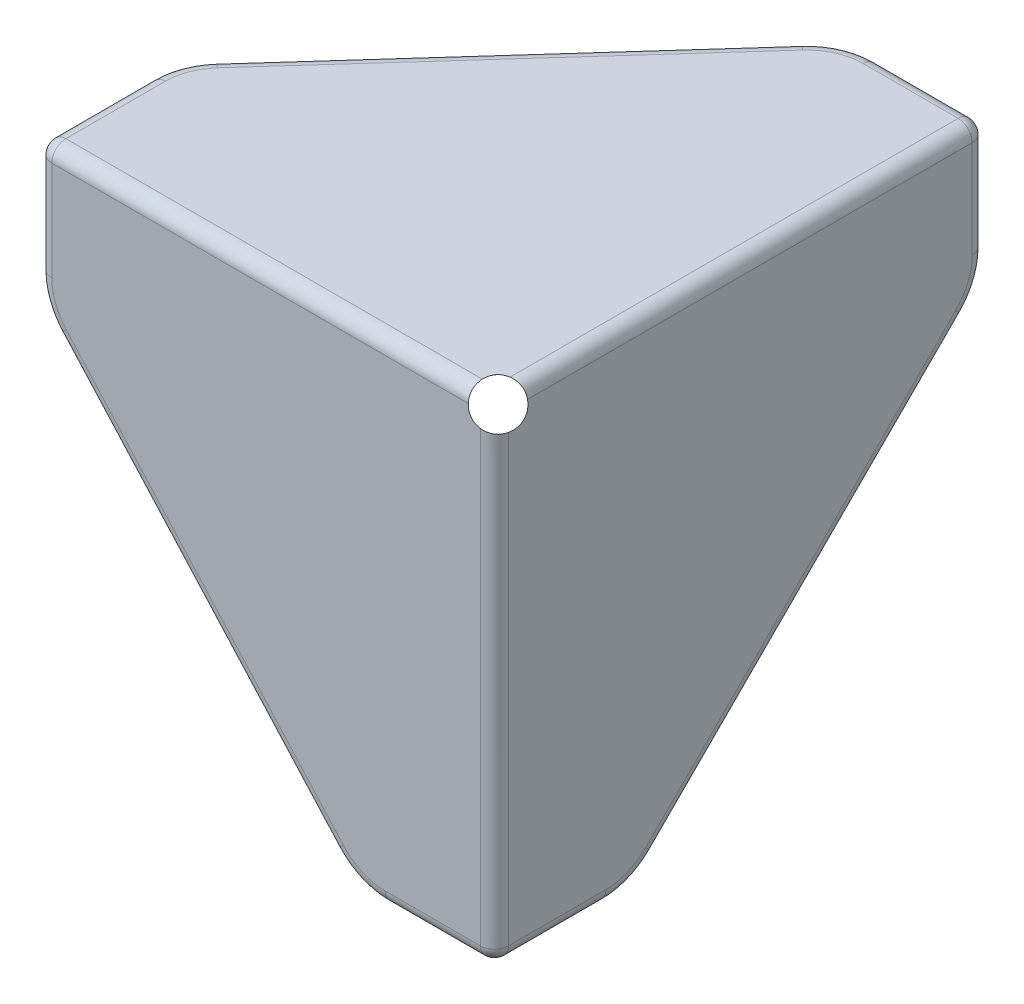
from build123d import *

# Parameters (mm, degrees)
RESSALTO_EXTRUS_O1_DEPTH   = 12
RESSALTO_EXTRUS_O2_DEPTH   = 12
RESSALTO_EXTRUS_O3_DEPTH   = 12
FILETE1_R                  = 10
FILETE2_R                  = 2
FILETE3_R                  = 2
ESBO_O11_R                 = 3.1
CORTE_EXTRUS_O4_DEPTH      = 40
ESBO_O12_R                 = 3.1
CORTE_EXTRUS_O5_DEPTH      = 40
ESBO_O10_R                 = 3.1
CORTE_EXTRUS_O6_DEPTH      = 40
CORTE_EXTRUS_O8_DEPTH      = 10
CORTE_EXTRUS_O8_DEPTH_BACK = 30
ESBO_O15_R                 = 3


with BuildPart() as part:
    # Esboço1 → Ressalto-extrusão1 (new body)
    with BuildSketch(Plane.XY):
        Polygon((7.254630019, -29.35114002), (-37.745369981, 20.64885998), (-37.745369981, 40.64885998), (27.254630019, 40.64885998), (27.254630019, -29.35114002), align=None)
    extrude(amount=RESSALTO_EXTRUS_O1_DEPTH)

    # Esboço2 → Ressalto-extrusão2 (add)
    with BuildSketch(Plane(origin=(0, 40.64885998, 0), x_dir=(1, 0, 0), z_dir=(0, 1, 0))):
        Polygon((7.254630019, 58), (-37.745369981, 8), (-37.745369981, -12), (27.254630019, -12), (27.254630019, 58), align=None)
    extrude(amount=-RESSALTO_EXTRUS_O2_DEPTH)

    # Esboço3 → Ressalto-extrusão3 (add)
    with BuildSketch(Plane(origin=(27.254630019, 0, 0), x_dir=(0, 0, -1), z_dir=(1, 0, 0))):
        Polygon((58, 20.64885998), (8, -29.35114002), (-12, -29.35114002), (-12, 40.64885998), (58, 40.64885998), align=None)
    extrude(amount=-RESSALTO_EXTRUS_O3_DEPTH)

    # Filete1
    filete1_edges = [part.edges().sort_by_distance(p)[0] for p in [
        (-37.745369981, 34.64885998, -8),
        (7.254630019, 34.64885998, -58),
        (21.254630019, -29.35114002, -8),
        (21.254630019, 20.64885998, -58),
        (7.254630019, -29.35114002, 6),
        (-37.745369981, 20.64885998, 6),
    ]]
    fillet(filete1_edges, radius=FILETE1_R)

    # Filete2
    filete2_edges = [part.edges().sort_by_distance(p)[0] for p in [
        (-37.745369981, 32.567540006, 12),
        (19.481442042, 40.64885998, -58),
        (27.254630019, 5.64885998, 12),
        (-15.45149942, 40.64885998, -32.77096729),
        (7.639868216, 40.64885998, -57.135000634),
        (-37.081574098, 40.64885998, -7.74527762),
        (-15.45149942, -4.12210731, 12),
        (19.481442042, -29.35114002, 12),
        (7.639868216, -28.486140654, 12),
        (-37.081574098, 20.90358236, 12),
        (27.254630019, -4.35114002, -33),
        (27.254630019, 32.719927792, -58),
        (27.254630019, 20.96416128, -57.238795325),
        (27.254630019, -28.589935345, -7.6846987),
        (-5.245369981, 40.64885998, 12),
        (27.254630019, -29.35114002, 4.071067812),
        (-37.745369981, 40.64885998, 3.918680026),
        (27.254630019, 40.64885998, -23),
    ]]
    fillet(filete2_edges, radius=FILETE2_R)

    # Filete3
    filete3_edges = [part.edges().sort_by_distance(p)[0] for p in [
        (-11.245369981, 28.64885998, 0),
        (15.254630019, -0.35114002, 0),
        (15.254630019, 28.64885998, -29),
    ]]
    fillet(filete3_edges, radius=FILETE3_R)

    # Esboço11 → Corte-extrusão4 (cut)
    with BuildSketch(Plane.ZY.offset(37.745369981)):
        with Locations(Location((4.707106781, 33.355966761, 0), (0, 0, 270))):
            Circle(ESBO_O11_R)
    extrude(amount=-CORTE_EXTRUS_O4_DEPTH, mode=Mode.SUBTRACT)

    # Esboço12 → Corte-extrusão5 (cut)
    with BuildSketch(Plane.XZ.offset(29.35114002)):
        with Locations(Location((19.9617368, 4.707106781, 0), (0, 0, 270))):
            Circle(ESBO_O12_R)
    extrude(amount=-CORTE_EXTRUS_O5_DEPTH, mode=Mode.SUBTRACT)

    # Esboço10 → Corte-extrusão6 (cut)
    with BuildSketch(Plane(origin=(0, 0, -58), x_dir=(-1, 0, 0), z_dir=(0, 0, -1))):
        with Locations((-19.9617368, 33.355966761)):
            Circle(ESBO_O10_R)
    extrude(amount=-CORTE_EXTRUS_O6_DEPTH, mode=Mode.SUBTRACT)

    # Esboço15 → Corte-extrusão8 (cut, two sides: drawn at the far end of the back side and taken through both)
    with BuildSketch(Plane(origin=(25.301163333, 25.301163333, 25.301163333), x_dir=(0.8164965809277263, -0.40824829046386346, -0.40824829046386246), z_dir=(0.5773502691896256, 0.5773502691896265, 0.5773502691896252)).offset(-CORTE_EXTRUS_O8_DEPTH_BACK)):
        with Locations(Location((1.188623136, 20.258589603, 0), (0, 0, 320.328232449))):
            Circle(ESBO_O15_R)
    extrude(amount=CORTE_EXTRUS_O8_DEPTH + CORTE_EXTRUS_O8_DEPTH_BACK, mode=Mode.SUBTRACT)


solid = part.part
